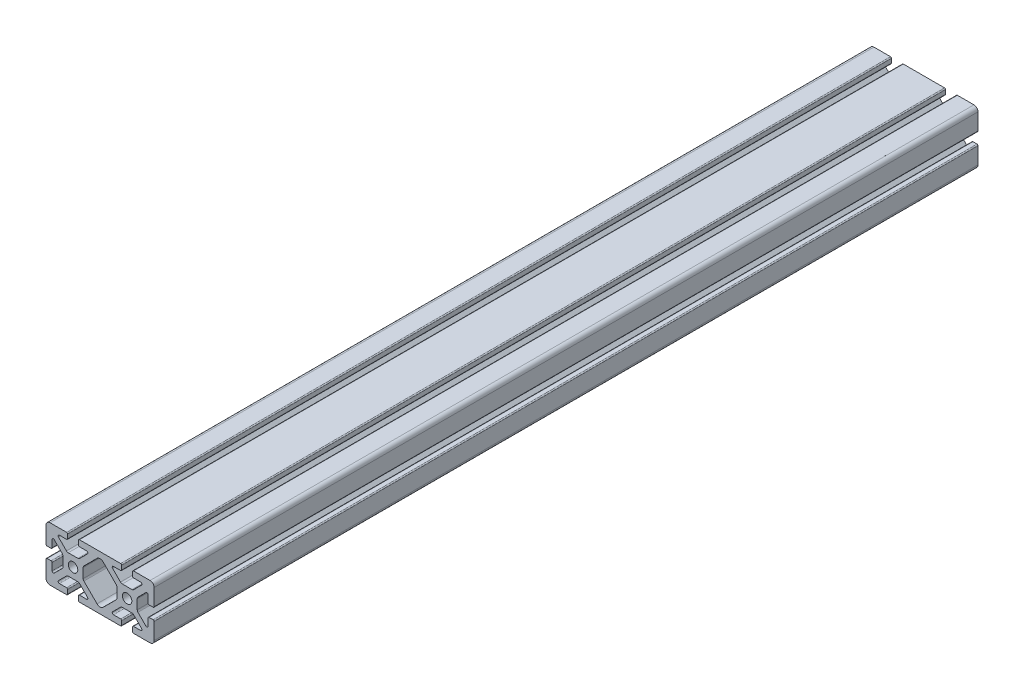
from build123d import *

# Parameters (mm, degrees)
SKETCH3_R           = 3.5
BOSS_EXTRUDE1_DEPTH = 304.8


with BuildPart() as part:
    # Sketch3 → Boss-Extrude1 (new, symmetric)
    with BuildSketch(Plane.XY):
        with BuildLine():
            Line((15.25, 20), (-15.25, 20))
            ThreePointArc((-15.25, 20), (-15.780330086, 19.780330086), (-16, 19.25))
            Line((-16, 19.25), (-16, 16.25))
            ThreePointArc((-16, 16.25), (-15.780330086, 15.719669914), (-15.25, 15.5))
            Line((-15.25, 15.5), (-9.931980515, 15.5))
            ThreePointArc((-9.931980515, 15.5), (-9.070942793, 14.924672987), (-9.272970773, 13.909009742))
            Line((-9.272970773, 13.909009742), (-15.140128061, 8.041852455))
            ThreePointArc((-15.140128061, 8.041852455), (-15.740311256, 7.640822865), (-16.448275606, 7.5))
            Line((-16.448275606, 7.5), (-23.551724394, 7.5))
            ThreePointArc((-23.551724394, 7.5), (-24.259688744, 7.640822865), (-24.859871939, 8.041852455))
            Line((-24.859871939, 8.041852455), (-30.727029227, 13.909009742))
            ThreePointArc((-30.727029227, 13.909009742), (-30.929057207, 14.924672987), (-30.068019485, 15.5))
            Line((-30.068019485, 15.5), (-24.75, 15.5))
            ThreePointArc((-24.75, 15.5), (-24.219669914, 15.719669914), (-24, 16.25))
            Line((-24, 16.25), (-24, 19.25))
            ThreePointArc((-24, 19.25), (-24.219669914, 19.780330086), (-24.75, 20))
            Line((-24.75, 20), (-37, 20))
            ThreePointArc((-37, 20), (-39.121320344, 19.121320344), (-40, 17))
            Line((-40, 17), (-40, 4.75))
            ThreePointArc((-40, 4.75), (-39.780330086, 4.219669914), (-39.25, 4))
            Line((-39.25, 4), (-36.25, 4))
            ThreePointArc((-36.25, 4), (-35.719669914, 4.219669914), (-35.5, 4.75))
            Line((-35.5, 4.75), (-35.5, 10.068019485))
            ThreePointArc((-35.5, 10.068019485), (-34.924672987, 10.929057207), (-33.909009742, 10.727029227))
            Line((-33.909009742, 10.727029227), (-28.041852455, 4.859871939))
            ThreePointArc((-28.041852455, 4.859871939), (-27.640822865, 4.259688744), (-27.5, 3.551724394))
            Line((-27.5, 3.551724394), (-27.5, -3.551724394))
            ThreePointArc((-27.5, -3.551724394), (-27.640822865, -4.259688744), (-28.041852455, -4.859871939))
            Line((-28.041852455, -4.859871939), (-33.909009742, -10.727029227))
            ThreePointArc((-33.909009742, -10.727029227), (-34.924672987, -10.929057207), (-35.5, -10.068019485))
            Line((-35.5, -10.068019485), (-35.5, -4.75))
            ThreePointArc((-35.5, -4.75), (-35.719669914, -4.219669914), (-36.25, -4))
            Line((-36.25, -4), (-39.25, -4))
            ThreePointArc((-39.25, -4), (-39.780330086, -4.219669914), (-40, -4.75))
            Line((-40, -4.75), (-40, -17))
            ThreePointArc((-40, -17), (-39.121320344, -19.121320344), (-37, -20))
            Line((-37, -20), (-24.75, -20))
            ThreePointArc((-24.75, -20), (-24.219669914, -19.780330086), (-24, -19.25))
            Line((-24, -19.25), (-24, -16.25))
            ThreePointArc((-24, -16.25), (-24.219669914, -15.719669914), (-24.75, -15.5))
            Line((-24.75, -15.5), (-30.068019485, -15.5))
            ThreePointArc((-30.068019485, -15.5), (-30.929057207, -14.924672987), (-30.727029227, -13.909009742))
            Line((-30.727029227, -13.909009742), (-24.859871939, -8.041852455))
            ThreePointArc((-24.859871939, -8.041852455), (-24.259688744, -7.640822865), (-23.551724394, -7.5))
            Line((-23.551724394, -7.5), (-16.448275606, -7.5))
            ThreePointArc((-16.448275606, -7.5), (-15.740311256, -7.640822865), (-15.140128061, -8.041852455))
            Line((-15.140128061, -8.041852455), (-9.272970773, -13.909009742))
            ThreePointArc((-9.272970773, -13.909009742), (-9.070942793, -14.924672987), (-9.931980515, -15.5))
            Line((-9.931980515, -15.5), (-15.25, -15.5))
            ThreePointArc((-15.25, -15.5), (-15.780330086, -15.719669914), (-16, -16.25))
            Line((-16, -16.25), (-16, -19.25))
            ThreePointArc((-16, -19.25), (-15.780330086, -19.780330086), (-15.25, -20))
            Line((-15.25, -20), (15.25, -20))
            ThreePointArc((15.25, -20), (15.780330086, -19.780330086), (16, -19.25))
            Line((16, -19.25), (16, -16.25))
            ThreePointArc((16, -16.25), (15.780330086, -15.719669914), (15.25, -15.5))
            Line((15.25, -15.5), (9.931980515, -15.5))
            ThreePointArc((9.931980515, -15.5), (9.070942793, -14.924672987), (9.272970773, -13.909009742))
            Line((9.272970773, -13.909009742), (15.140128061, -8.041852455))
            ThreePointArc((15.140128061, -8.041852455), (15.740311256, -7.640822865), (16.448275606, -7.5))
            Line((16.448275606, -7.5), (23.551724394, -7.5))
            ThreePointArc((23.551724394, -7.5), (24.259688744, -7.640822865), (24.859871939, -8.041852455))
            Line((24.859871939, -8.041852455), (30.727029227, -13.909009742))
            ThreePointArc((30.727029227, -13.909009742), (30.929057207, -14.924672987), (30.068019485, -15.5))
            Line((30.068019485, -15.5), (24.75, -15.5))
            ThreePointArc((24.75, -15.5), (24.219669914, -15.719669914), (24, -16.25))
            Line((24, -16.25), (24, -19.25))
            ThreePointArc((24, -19.25), (24.219669914, -19.780330086), (24.75, -20))
            Line((24.75, -20), (37, -20))
            ThreePointArc((37, -20), (39.121320344, -19.121320344), (40, -17))
            Line((40, -17), (40, -4.75))
            ThreePointArc((40, -4.75), (39.780330086, -4.219669914), (39.25, -4))
            Line((39.25, -4), (36.25, -4))
            ThreePointArc((36.25, -4), (35.719669914, -4.219669914), (35.5, -4.75))
            Line((35.5, -4.75), (35.5, -10.068019485))
            ThreePointArc((35.5, -10.068019485), (34.924672987, -10.929057207), (33.909009742, -10.727029227))
            Line((33.909009742, -10.727029227), (28.041852455, -4.859871939))
            ThreePointArc((28.041852455, -4.859871939), (27.640822865, -4.259688744), (27.5, -3.551724394))
            Line((27.5, -3.551724394), (27.5, 3.551724394))
            ThreePointArc((27.5, 3.551724394), (27.640822865, 4.259688744), (28.041852455, 4.859871939))
            Line((28.041852455, 4.859871939), (33.909009742, 10.727029227))
            ThreePointArc((33.909009742, 10.727029227), (34.924672987, 10.929057207), (35.5, 10.068019485))
            Line((35.5, 10.068019485), (35.5, 4.75))
            ThreePointArc((35.5, 4.75), (35.719669914, 4.219669914), (36.25, 4))
            Line((36.25, 4), (39.25, 4))
            ThreePointArc((39.25, 4), (39.780330086, 4.219669914), (40, 4.75))
            Line((40, 4.75), (40, 17))
            ThreePointArc((40, 17), (39.121320344, 19.121320344), (37, 20))
            Line((37, 20), (24.75, 20))
            ThreePointArc((24.75, 20), (24.219669914, 19.780330086), (24, 19.25))
            Line((24, 19.25), (24, 16.25))
            ThreePointArc((24, 16.25), (24.219669914, 15.719669914), (24.75, 15.5))
            Line((24.75, 15.5), (30.068019485, 15.5))
            ThreePointArc((30.068019485, 15.5), (30.929057207, 14.924672987), (30.727029227, 13.909009742))
            Line((30.727029227, 13.909009742), (24.859871939, 8.041852455))
            ThreePointArc((24.859871939, 8.041852455), (24.259688744, 7.640822865), (23.551724394, 7.5))
            Line((23.551724394, 7.5), (16.448275606, 7.5))
            ThreePointArc((16.448275606, 7.5), (15.740311256, 7.640822865), (15.140128061, 8.041852455))
            Line((15.140128061, 8.041852455), (9.272970773, 13.909009742))
            ThreePointArc((9.272970773, 13.909009742), (9.070942793, 14.924672987), (9.931980515, 15.5))
            Line((9.931980515, 15.5), (15.25, 15.5))
            ThreePointArc((15.25, 15.5), (15.780330086, 15.719669914), (16, 16.25))
            Line((16, 16.25), (16, 19.25))
            ThreePointArc((16, 19.25), (15.780330086, 19.780330086), (15.25, 20))
        make_face()
        with Locations(Location((-20, 0, 0), (0, 0, 180))):
            Circle(SKETCH3_R, mode=Mode.SUBTRACT)
        with Locations(Location((20, 0, 0), (0, 0, 180))):
            Circle(SKETCH3_R, mode=Mode.SUBTRACT)
        with BuildLine():
            Line((-2.25, -14.568019485), (-11.958147545, -4.859871939))
            ThreePointArc((-11.958147545, -4.859871939), (-12.359177135, -4.259688744), (-12.5, -3.551724394))
            Line((-12.5, -3.551724394), (-12.5, 3.551724394))
            ThreePointArc((-12.5, 3.551724394), (-12.359177135, 4.259688744), (-11.958147545, 4.859871939))
            Line((-11.958147545, 4.859871939), (-2.25, 14.568019485))
            ThreePointArc((-2.25, 14.568019485), (0, 15.5), (2.25, 14.568019485))
            Line((2.25, 14.568019485), (11.958147545, 4.859871939))
            ThreePointArc((11.958147545, 4.859871939), (12.359177135, 4.259688744), (12.5, 3.551724394))
            Line((12.5, 3.551724394), (12.5, -3.551724394))
            ThreePointArc((12.5, -3.551724394), (12.359177135, -4.259688744), (11.958147545, -4.859871939))
            Line((11.958147545, -4.859871939), (2.25, -14.568019485))
            ThreePointArc((2.25, -14.568019485), (0, -15.5), (-2.25, -14.568019485))
        make_face(mode=Mode.SUBTRACT)
    extrude(amount=BOSS_EXTRUDE1_DEPTH, both=True)


solid = part.part
